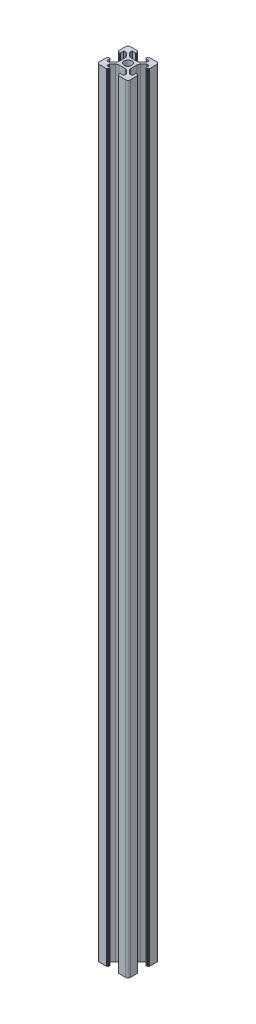
from build123d import *

# Parameters (mm, degrees)
SKETCH_11_R            = 2.5
MEMBER_20_2020_1_DEPTH = 500


with BuildPart() as part:
    # 草图11 → Member 20 2020_1 (new body)
    with BuildSketch(Plane(origin=(-84.210526316, 190.350877193, 0), x_dir=(1, 0, 0), z_dir=(0, -1, 0))):
        with BuildLine():
            Line((3.9, 0), (3.9, -2.010912703))
            ThreePointArc((3.9, -2.010912703), (4.052240935, -2.776279568), (4.485786438, -3.425126266))
            Line((4.485786438, -3.425126266), (6.560660172, -5.5))
            Line((6.560660172, -5.5), (7.9, -5.5))
            ThreePointArc((7.9, -5.5), (8.112132034, -5.412132034), (8.2, -5.2))
            Line((8.2, -5.2), (8.2, -3.4))
            ThreePointArc((8.2, -3.4), (8.287867966, -3.187867966), (8.5, -3.1))
            Line((8.5, -3.1), (9.2, -3.1))
            ThreePointArc((9.2, -3.1), (9.412132034, -3.187867966), (9.5, -3.4))
            Line((9.5, -3.4), (9.5, -3.6))
            Line((9.5, -3.6), (9.7, -3.6))
            ThreePointArc((9.7, -3.6), (9.912132034, -3.687867966), (10, -3.9))
            Line((10, -3.9), (10, -8.5))
            ThreePointArc((10, -8.5), (9.560660172, -9.560660172), (8.5, -10))
            Line((8.5, -10), (3.9, -10))
            ThreePointArc((3.9, -10), (3.687867966, -9.912132034), (3.6, -9.7))
            ThreePointArc((3.6, -9.7), (3.541421356, -9.558578644), (3.4, -9.5))
            ThreePointArc((3.4, -9.5), (3.187867966, -9.412132034), (3.1, -9.2))
            Line((3.1, -9.2), (3.1, -8.5))
            ThreePointArc((3.1, -8.5), (3.187867966, -8.287867966), (3.4, -8.2))
            Line((3.4, -8.2), (5.2, -8.2))
            ThreePointArc((5.2, -8.2), (5.412132034, -8.112132034), (5.5, -7.9))
            Line((5.5, -7.9), (5.5, -6.68492424))
            ThreePointArc((5.5, -6.68492424), (5.47716386, -6.570119211), (5.412132034, -6.472792206))
            Line((5.412132034, -6.472792206), (3.425126266, -4.485786438))
            ThreePointArc((3.425126266, -4.485786438), (2.776279568, -4.052240935), (2.010912703, -3.9))
            Line((2.010912703, -3.9), (0, -3.9))
            Line((0, -3.9), (-2.010912703, -3.9))
            ThreePointArc((-2.010912703, -3.9), (-2.776279568, -4.052240935), (-3.425126266, -4.485786438))
            Line((-3.425126266, -4.485786438), (-5.412132034, -6.472792206))
            ThreePointArc((-5.412132034, -6.472792206), (-5.47716386, -6.570119211), (-5.5, -6.68492424))
            Line((-5.5, -6.68492424), (-5.5, -7.9))
            ThreePointArc((-5.5, -7.9), (-5.412132034, -8.112132034), (-5.2, -8.2))
            Line((-5.2, -8.2), (-3.4, -8.2))
            ThreePointArc((-3.4, -8.2), (-3.187867966, -8.287867966), (-3.1, -8.5))
            Line((-3.1, -8.5), (-3.1, -9.2))
            ThreePointArc((-3.1, -9.2), (-3.187867966, -9.412132034), (-3.4, -9.5))
            ThreePointArc((-3.4, -9.5), (-3.541421356, -9.558578644), (-3.6, -9.7))
            ThreePointArc((-3.6, -9.7), (-3.687867966, -9.912132034), (-3.9, -10))
            Line((-3.9, -10), (-8.5, -10))
            ThreePointArc((-8.5, -10), (-9.560660172, -9.560660172), (-10, -8.5))
            Line((-10, -8.5), (-10, -3.9))
            ThreePointArc((-10, -3.9), (-9.912132034, -3.687867966), (-9.7, -3.6))
            Line((-9.7, -3.6), (-9.5, -3.6))
            Line((-9.5, -3.6), (-9.5, -3.4))
            ThreePointArc((-9.5, -3.4), (-9.412132034, -3.187867966), (-9.2, -3.1))
            Line((-9.2, -3.1), (-8.5, -3.1))
            ThreePointArc((-8.5, -3.1), (-8.287867965, -3.187867966), (-8.2, -3.4))
            Line((-8.2, -3.4), (-8.2, -5.2))
            ThreePointArc((-8.2, -5.2), (-8.112132034, -5.412132034), (-7.9, -5.5))
            Line((-7.9, -5.5), (-6.68492424, -5.5))
            ThreePointArc((-6.68492424, -5.5), (-6.570119211, -5.47716386), (-6.472792206, -5.412132034))
            Line((-6.472792206, -5.412132034), (-4.485786438, -3.425126266))
            ThreePointArc((-4.485786438, -3.425126266), (-4.052240935, -2.776279568), (-3.9, -2.010912703))
            Line((-3.9, -2.010912703), (-3.9, 0))
            Line((-3.9, 0), (-3.9, 2.010912703))
            ThreePointArc((-3.9, 2.010912703), (-4.052240935, 2.776279568), (-4.485786438, 3.425126266))
            Line((-4.485786438, 3.425126266), (-6.472792206, 5.412132034))
            ThreePointArc((-6.472792206, 5.412132034), (-6.570119211, 5.47716386), (-6.68492424, 5.5))
            Line((-6.68492424, 5.5), (-7.9, 5.5))
            ThreePointArc((-7.9, 5.5), (-8.112132034, 5.412132034), (-8.2, 5.2))
            Line((-8.2, 5.2), (-8.2, 3.4))
            ThreePointArc((-8.2, 3.4), (-8.287867965, 3.187867966), (-8.5, 3.1))
            Line((-8.5, 3.1), (-9.2, 3.1))
            ThreePointArc((-9.2, 3.1), (-9.412132034, 3.187867966), (-9.5, 3.4))
            Line((-9.5, 3.4), (-9.5, 3.6))
            Line((-9.5, 3.6), (-9.7, 3.6))
            ThreePointArc((-9.7, 3.6), (-9.912132034, 3.687867966), (-10, 3.9))
            Line((-10, 3.9), (-10, 8.5))
            ThreePointArc((-10, 8.5), (-9.560660172, 9.560660172), (-8.5, 10))
            Line((-8.5, 10), (-3.9, 10))
            ThreePointArc((-3.9, 10), (-3.687867966, 9.912132034), (-3.6, 9.7))
            Line((-3.6, 9.7), (-3.6, 9.5))
            Line((-3.6, 9.5), (-3.4, 9.5))
            ThreePointArc((-3.4, 9.5), (-3.187867966, 9.412132034), (-3.1, 9.2))
            Line((-3.1, 9.2), (-3.1, 8.5))
            ThreePointArc((-3.1, 8.5), (-3.187867966, 8.287867966), (-3.4, 8.2))
            Line((-3.4, 8.2), (-5.2, 8.2))
            ThreePointArc((-5.2, 8.2), (-5.412132034, 8.112132034), (-5.5, 7.9))
            Line((-5.5, 7.9), (-5.5, 6.68492424))
            ThreePointArc((-5.5, 6.68492424), (-5.47716386, 6.570119211), (-5.412132034, 6.472792206))
            Line((-5.412132034, 6.472792206), (-3.425126266, 4.485786438))
            ThreePointArc((-3.425126266, 4.485786438), (-2.776279568, 4.052240935), (-2.010912703, 3.9))
            Line((-2.010912703, 3.9), (0, 3.9))
            Line((0, 3.9), (2.010912703, 3.9))
            ThreePointArc((2.010912703, 3.9), (2.776279568, 4.052240935), (3.425126266, 4.485786438))
            Line((3.425126266, 4.485786438), (5.412132034, 6.472792206))
            ThreePointArc((5.412132034, 6.472792206), (5.47716386, 6.570119211), (5.5, 6.68492424))
            Line((5.5, 6.68492424), (5.5, 7.9))
            ThreePointArc((5.5, 7.9), (5.412132034, 8.112132034), (5.2, 8.2))
            Line((5.2, 8.2), (3.4, 8.2))
            ThreePointArc((3.4, 8.2), (3.187867966, 8.287867966), (3.1, 8.5))
            Line((3.1, 8.5), (3.1, 9.2))
            ThreePointArc((3.1, 9.2), (3.187867966, 9.412132034), (3.4, 9.5))
            Line((3.4, 9.5), (3.6, 9.5))
            Line((3.6, 9.5), (3.6, 9.7))
            ThreePointArc((3.6, 9.7), (3.687867966, 9.912132034), (3.9, 10))
            Line((3.9, 10), (8.5, 10))
            ThreePointArc((8.5, 10), (9.560660172, 9.560660172), (10, 8.5))
            Line((10, 8.5), (10, 3.9))
            ThreePointArc((10, 3.9), (9.912132034, 3.687867966), (9.7, 3.6))
            Line((9.7, 3.6), (9.5, 3.6))
            Line((9.5, 3.6), (9.5, 3.4))
            ThreePointArc((9.5, 3.4), (9.412132034, 3.187867966), (9.2, 3.1))
            Line((9.2, 3.1), (8.5, 3.1))
            ThreePointArc((8.5, 3.1), (8.287867966, 3.187867966), (8.2, 3.4))
            Line((8.2, 3.4), (8.2, 5.2))
            ThreePointArc((8.2, 5.2), (8.112132034, 5.412132034), (7.9, 5.5))
            Line((7.9, 5.5), (6.68492424, 5.5))
            ThreePointArc((6.68492424, 5.5), (6.570119211, 5.47716386), (6.472792206, 5.412132034))
            Line((6.472792206, 5.412132034), (4.485786438, 3.425126266))
            ThreePointArc((4.485786438, 3.425126266), (4.052240935, 2.776279568), (3.9, 2.010912703))
            Line((3.9, 2.010912703), (3.9, 0))
        make_face()
        Circle(SKETCH_11_R, mode=Mode.SUBTRACT)
    extrude(amount=MEMBER_20_2020_1_DEPTH)


solid = part.part
